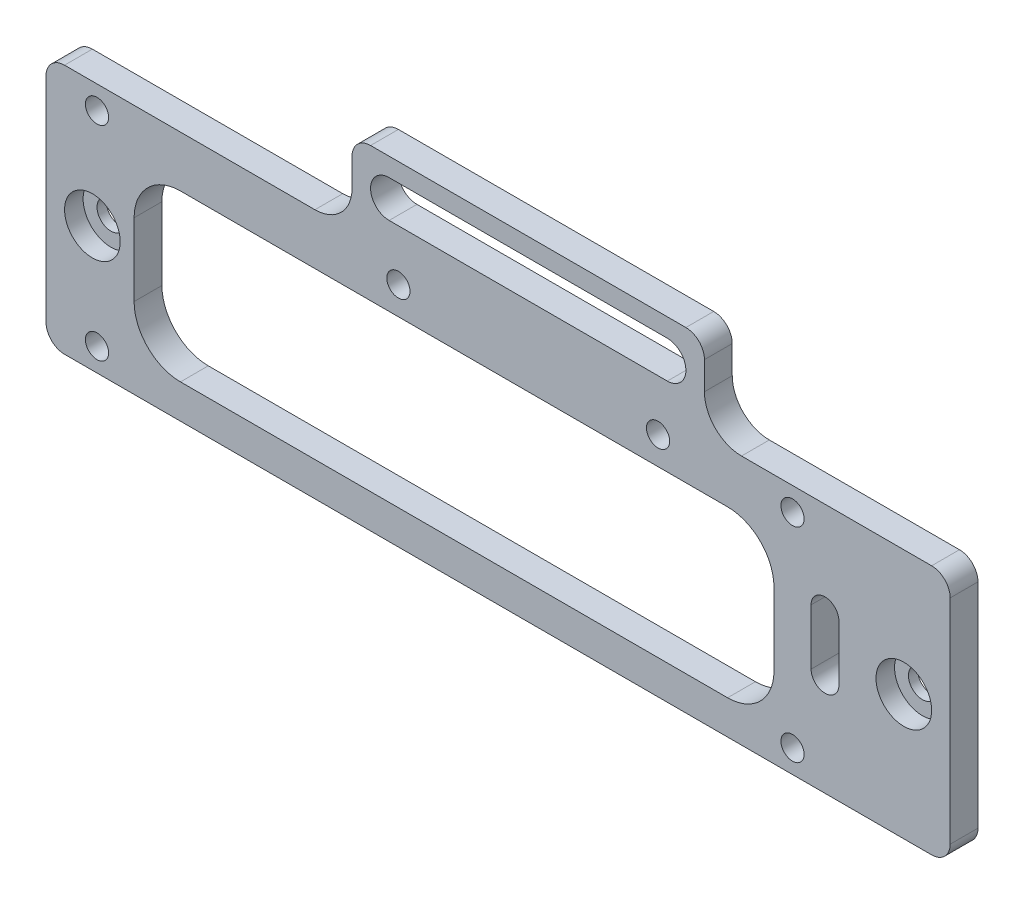
from build123d import *

# Parameters (mm, degrees)
SKETCH_3_W               = 97.5
SKETCH_3_H               = 27
EXTRUDE_1_DEPTH          = 3
SKETCH_4_R               = 1.25
CUT_EXTRUDE_1_DEPTH      = 51.673587795
SKETCH_7_W               = 4
SKETCH_7_H               = 8
EXTRUDE_2_DEPTH          = 5
SKETCH_8_W               = 38
SKETCH_8_H               = 9
EXTRUDE_3_DEPTH          = 3
FILLET_3_R               = 4
FILLET_4_R               = 2
CUT_EXTRUDE_4_DEPTH      = 55.284551209
CUT_EXTRUDE_4_DEPTH_BACK = 5
SKETCH_9_W               = 4
SKETCH_9_H               = 8
SKETCH_13_R              = 1.5
CUT_EXTRUDE_7_DEPTH      = 54.775575311
CUT_EXTRUDE_8_DEPTH      = 54.775575311
SKETCH_16_R              = 3
CUT_EXTRUDE_9_DEPTH      = 2
CUT_EXTRUDE_10_DEPTH     = 10
FILLET_5_R               = 5
FILLET_6_R               = 2


with BuildPart() as part:
    # 草图3 → 凸台-拉伸1 (new body)
    with BuildSketch(Plane.XY):
        Rectangle(SKETCH_3_W, SKETCH_3_H)
    extrude(amount=EXTRUDE_1_DEPTH)

    # 草图4 → 切除-拉伸1 (cut, through all)
    with BuildSketch(Plane.XY.offset(3)):
        with Locations((-43.25, 11)):
            Circle(SKETCH_4_R)
        with Locations((-43.25, -11)):
            Circle(SKETCH_4_R)
        with Locations((31.75, 11)):
            Circle(SKETCH_4_R)
        with Locations((31.75, -11)):
            Circle(SKETCH_4_R)
        with Locations((17.25, 11)):
            Circle(SKETCH_4_R)
        with Locations((-10.75, 11)):
            Circle(SKETCH_4_R)
    extrude(amount=-CUT_EXTRUDE_1_DEPTH, mode=Mode.SUBTRACT)

    # 草图7 → 凸台-拉伸2 (add)
    with BuildSketch(Plane(origin=(0, 0, 0), x_dir=(-1, 0, 0), z_dir=(0, 0, -1))):
        with Locations((46.75, 0.5)):
            Rectangle(SKETCH_7_W, SKETCH_7_H)
        with Locations((-46.75, 0.5)):
            Rectangle(SKETCH_7_W, SKETCH_7_H)
    extrude(amount=EXTRUDE_2_DEPTH)

    # 草图8 → 凸台-拉伸3 (add)
    with BuildSketch(Plane.XY.offset(3)):
        with Locations((3.25, 18)):
            Rectangle(SKETCH_8_W, SKETCH_8_H)
        with BuildLine():
            Line((-11.75, 20.5), (18.25, 20.5))
            ThreePointArc((18.25, 20.5), (20.25, 18.5), (18.25, 16.5))
            Line((18.25, 16.5), (-11.75, 16.5))
            ThreePointArc((-11.75, 16.5), (-13.75, 18.5), (-11.75, 20.5))
        make_face(mode=Mode.SUBTRACT)
    extrude(amount=-EXTRUDE_3_DEPTH)

    # 圆角3
    fillet_3_edges = [part.edges().sort_by_distance(p)[0] for p in [
        (22.25, 13.5, 1.5),
        (-15.75, 13.5, 1.5),
    ]]
    fillet(fillet_3_edges, radius=FILLET_3_R)

    # 圆角4
    fillet_4_edges = [part.edges().sort_by_distance(p)[0] for p in [
        (22.25, 22.5, 1.5),
        (-15.75, 22.5, 1.5),
    ]]
    fillet(fillet_4_edges, radius=FILLET_4_R)

    # 草图9 → 切除-拉伸4 (cut, two sides: drawn at the far end of the back side and taken through both)
    with BuildSketch(Plane(origin=(0, 0, -5), x_dir=(-1, 0, 0), z_dir=(0, 0, -1)).offset(-CUT_EXTRUDE_4_DEPTH_BACK)):
        with Locations((-46.75, 0.5)):
            Rectangle(SKETCH_9_W, SKETCH_9_H)
        with Locations((46.75, 0.5)):
            Rectangle(SKETCH_9_W, SKETCH_9_H)
    extrude(amount=CUT_EXTRUDE_4_DEPTH + CUT_EXTRUDE_4_DEPTH_BACK, mode=Mode.SUBTRACT)

    # 草图13 → 切除-拉伸7 (cut, through all)
    with BuildSketch(Plane(origin=(0, 0, 0), x_dir=(-1, 0, 0), z_dir=(0, 0, -1))):
        with Locations((-43.75, 0)):
            Circle(SKETCH_13_R)
        with Locations((43.75, 0)):
            Circle(SKETCH_13_R)
    extrude(amount=-CUT_EXTRUDE_7_DEPTH, mode=Mode.SUBTRACT)

    # 草图14 → 切除-拉伸8 (cut, through all)
    with BuildSketch(Plane.XY.offset(3)):
        with BuildLine():
            Line((36.75, 3.35), (36.75, -2.65))
            ThreePointArc((36.75, -2.65), (35.25, -4.15), (33.75, -2.65))
            Line((33.75, -2.65), (33.75, 3.35))
            ThreePointArc((33.75, 3.35), (35.25, 4.85), (36.75, 3.35))
        make_face()
    extrude(amount=-CUT_EXTRUDE_8_DEPTH, mode=Mode.SUBTRACT)

    # 草图16 → 切除-拉伸9 (cut)
    with BuildSketch(Plane.XY.offset(3)):
        with Locations((-43.75, 0)):
            Circle(SKETCH_16_R)
        with Locations((43.75, 0)):
            Circle(SKETCH_16_R)
    extrude(amount=-CUT_EXTRUDE_9_DEPTH, mode=Mode.SUBTRACT)

    # 草图17 → 切除-拉伸10 (cut)
    with BuildSketch(Plane(origin=(0, 0, 0), x_dir=(-1, 0, 0), z_dir=(0, 0, -1))):
        Polygon((39.25, -8), (39.25, 8), (-27.75, 8), (-29.75, 8), (-29.75, -9.826666667), (-27.75, -9.826666667), (39.25, -9.826666667), align=None)
    extrude(amount=-CUT_EXTRUDE_10_DEPTH, mode=Mode.SUBTRACT)

    # 圆角5
    fillet_5_edges = [part.edges().sort_by_distance(p)[0] for p in [
        (29.75, 8, 1.5),
        (-39.25, 8, 1.5),
        (-39.25, -9.826666667, 1.5),
        (29.75, -9.826666667, 1.5),
    ]]
    fillet(fillet_5_edges, radius=FILLET_5_R)

    # 圆角6
    fillet_6_edges = [part.edges().sort_by_distance(p)[0] for p in [
        (48.75, -13.5, 1.5),
        (-48.75, -13.5, 1.5),
        (-48.75, 13.5, 1.5),
        (48.75, 13.5, 1.5),
    ]]
    fillet(fillet_6_edges, radius=FILLET_6_R)


solid = part.part
